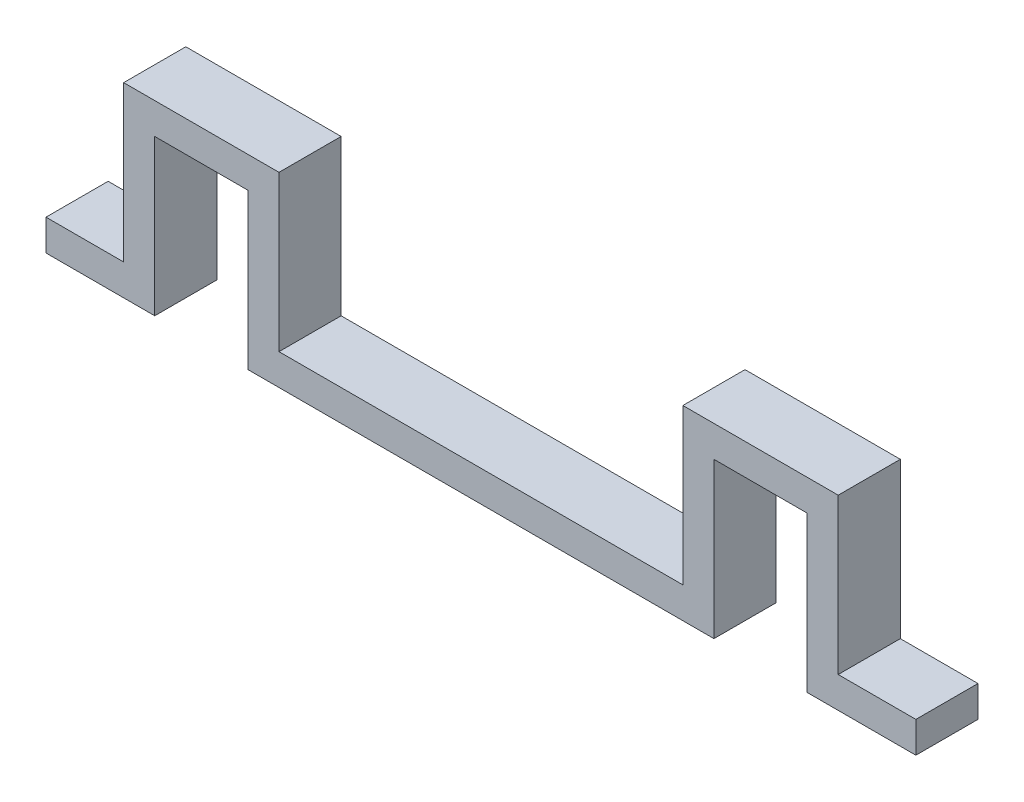
from build123d import *

# Parameters (mm, degrees)
BOSS_EXTRUDE1_DEPTH = 10


with BuildPart() as part:
    # Sketch1 → Boss-Extrude1 (new body)
    with BuildSketch(Plane.XY):
        Polygon((-182.199442144, -97.900596595), (-169.699442144, -97.900596595), (-169.699442144, -72.900596595), (-144.699442144, -72.900596595), (-144.699442144, -97.900596595), (-79.699442144, -97.900596595), (-79.699442144, -72.900596595), (-54.699442144, -72.900596595), (-54.699442144, -97.900596595), (-42.199442144, -97.900596595), (-42.199442144, -102.900596595), (-59.699442144, -102.900596595), (-59.699442144, -77.900596595), (-74.699442144, -77.900596595), (-74.699442144, -102.900596595), (-149.699442144, -102.900596595), (-149.699442144, -77.900596595), (-164.699442144, -77.900596595), (-164.699442144, -102.900596595), (-182.199442144, -102.900596595), align=None)
    extrude(amount=BOSS_EXTRUDE1_DEPTH)


solid = part.part
